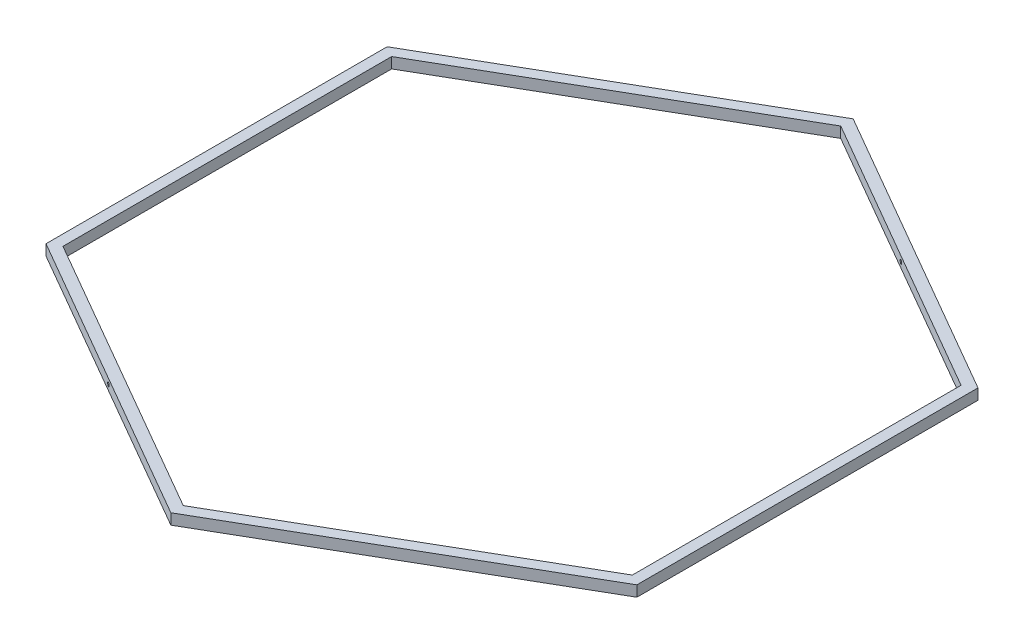
from build123d import *

# Parameters (mm, degrees)
RESSALTO_EXTRUS_O1_DEPTH = 4
ESBO_O2_R                = 0.75
CORTE_EXTRUS_O1_DEPTH    = 277.856160006


with BuildPart() as part:
    # Esboço1 → Ressalto-extrusão1 (new body)
    with BuildSketch(Plane(origin=(0, 0, 0), x_dir=(1, 0, 0), z_dir=(0, 1, 0))):
        Polygon((110, -63.508529611), (110, 63.508529611), (0, 127.017059222), (-110, 63.508529611), (-110, -63.508529611), (0, -127.017059222), align=None)
        Polygon((106, 61.199128534), (0, 122.398257068), (-106, 61.199128534), (-106, -61.199128534), (0, -122.398257068), (106, -61.199128534), align=None, mode=Mode.SUBTRACT)
    extrude(amount=RESSALTO_EXTRUS_O1_DEPTH)

    # Esboço2 → Corte-extrusão1 (cut, through all)
    with BuildSketch(Plane(origin=(-55, 0, 95.262794416), x_dir=(0.8660254037844387, 0, 0.49999999999999994), z_dir=(-0.4999999999999999, 0, 0.8660254037844386))):
        with Locations((0, 2)):
            Circle(ESBO_O2_R)
    extrude(amount=-CORTE_EXTRUS_O1_DEPTH, mode=Mode.SUBTRACT)


solid = part.part
